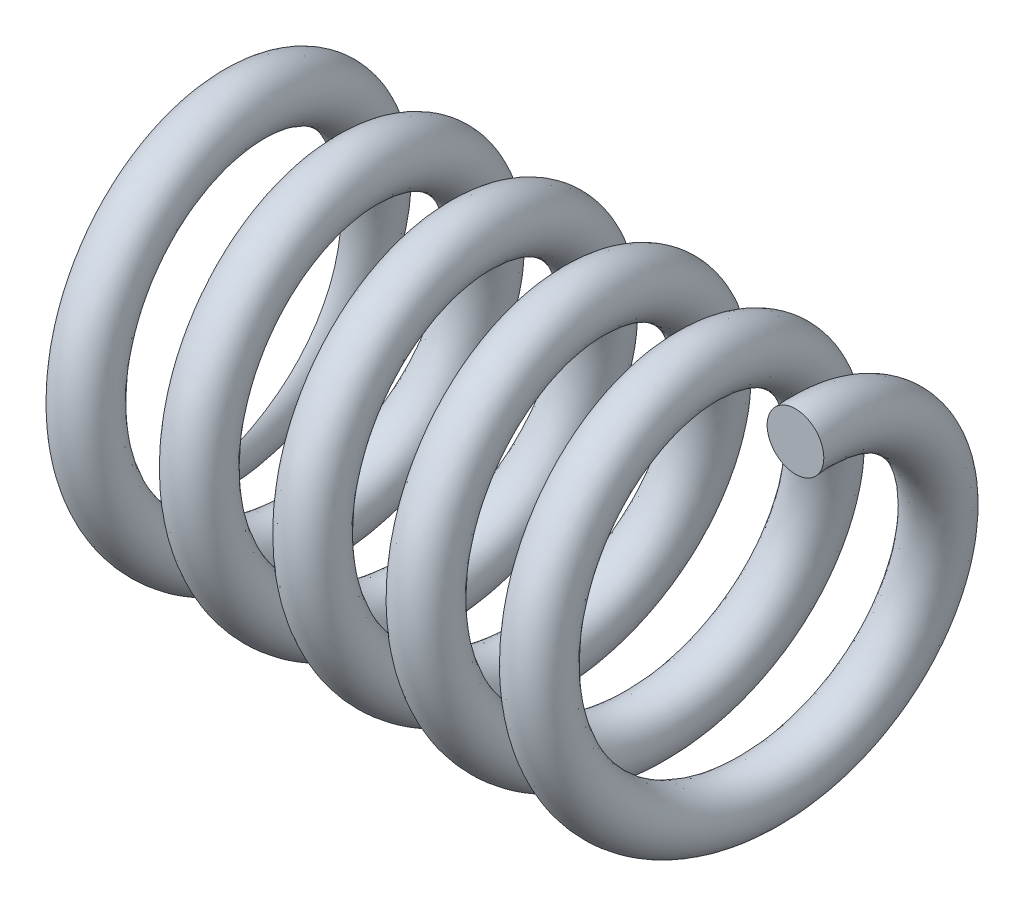
from build123d import *

# Parameters (mm, degrees)
VARREDURA1_PITCH           = 4
VARREDURA1_HEIGHT          = 22
VARREDURA1_RADIUS          = 6
VARREDURA1_START_ANGLE     = -90
ESBO_O3_R                  = 1
CORTE_EXTRUS_O1_DEPTH      = 23
CORTE_EXTRUS_O1_DEPTH_BACK = 13
ESBO_O4_W                  = 3.095344301
ESBO_O4_H                  = 18.16184874


with BuildPart() as part:
    # Varredura1: sweep along a helix
    with BuildLine() as varredura1_path:
        add(Helix(VARREDURA1_PITCH, VARREDURA1_HEIGHT, VARREDURA1_RADIUS, center=(0, 0, 0), direction=(-1, 0, 0), mode=Mode.PRIVATE).rotate(Axis((0, 0, 0), (-1, 0, 0)), VARREDURA1_START_ANGLE))
    # Esboço3 → Varredura1 (sweep)
    with BuildSketch(Plane.XY):
        with Locations((0, 6)):
            Circle(ESBO_O3_R)
    sweep(path=varredura1_path.line, is_frenet=True)

    # Esboço4 → Corte-extrusão1 (cut, two sides: drawn at the far end of the back side and taken through both)
    with BuildSketch(Plane.XY.offset(-CORTE_EXTRUS_O1_DEPTH_BACK)):
        with Locations((-22.573421464, 0.28926043)):
            Rectangle(ESBO_O4_W, ESBO_O4_H)
    extrude(amount=CORTE_EXTRUS_O1_DEPTH + CORTE_EXTRUS_O1_DEPTH_BACK, mode=Mode.SUBTRACT)


solid = part.part
